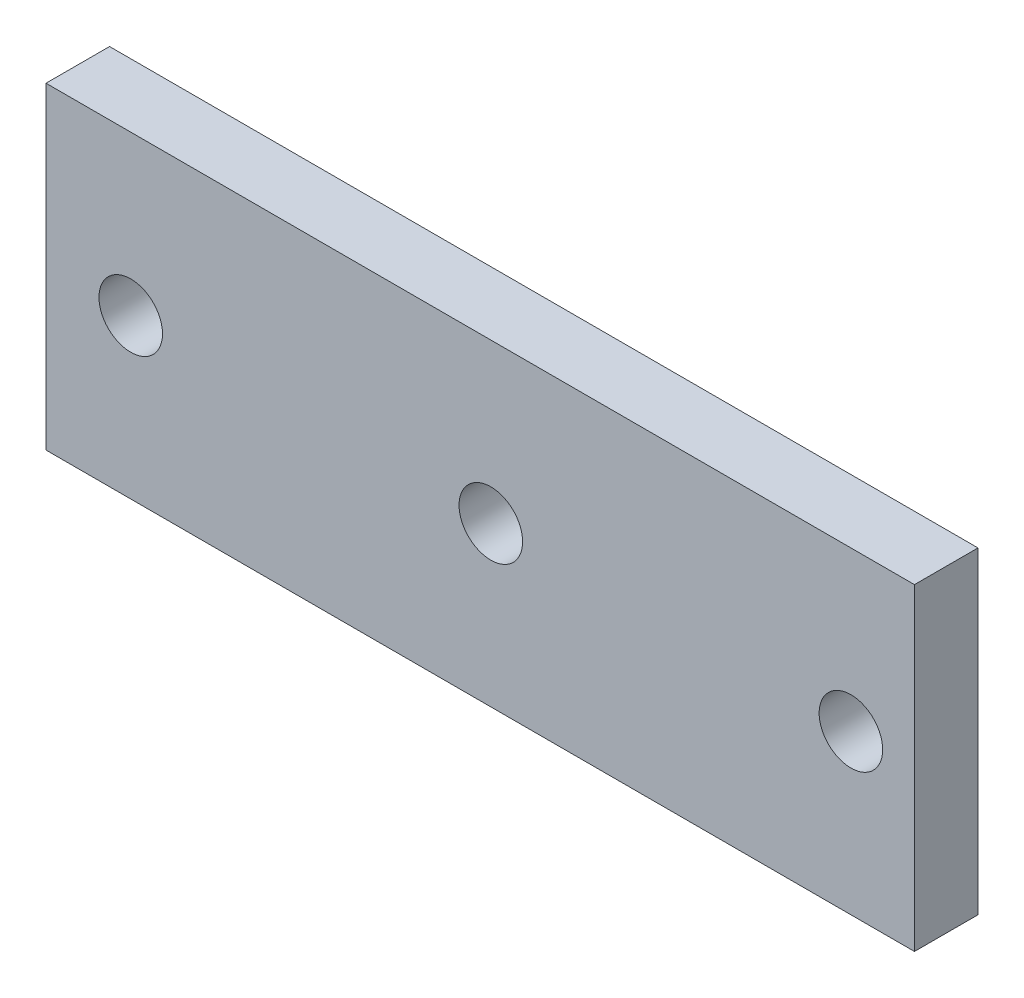
from build123d import *

# Parameters (mm, degrees)
SKETCH_1_W          = 41
SKETCH_1_H          = 15
EXTRUDE_1_DEPTH     = 3
SKETCH_2_R          = 1.5
CUT_EXTRUDE_1_DEPTH = 23.034064537


with BuildPart() as part:
    # 草图1 → 凸台-拉伸1 (new body)
    with BuildSketch(Plane.XY):
        Rectangle(SKETCH_1_W, SKETCH_1_H)
    extrude(amount=EXTRUDE_1_DEPTH)

    # 草图2 → 切除-拉伸1 (cut, through all)
    with BuildSketch(Plane.XY.offset(3)):
        with Locations((-16.5, 0)):
            Circle(SKETCH_2_R)
        with Locations((0.5, 0)):
            Circle(SKETCH_2_R)
        with Locations((17.5, 0)):
            Circle(SKETCH_2_R)
    extrude(amount=-CUT_EXTRUDE_1_DEPTH, mode=Mode.SUBTRACT)


solid = part.part
